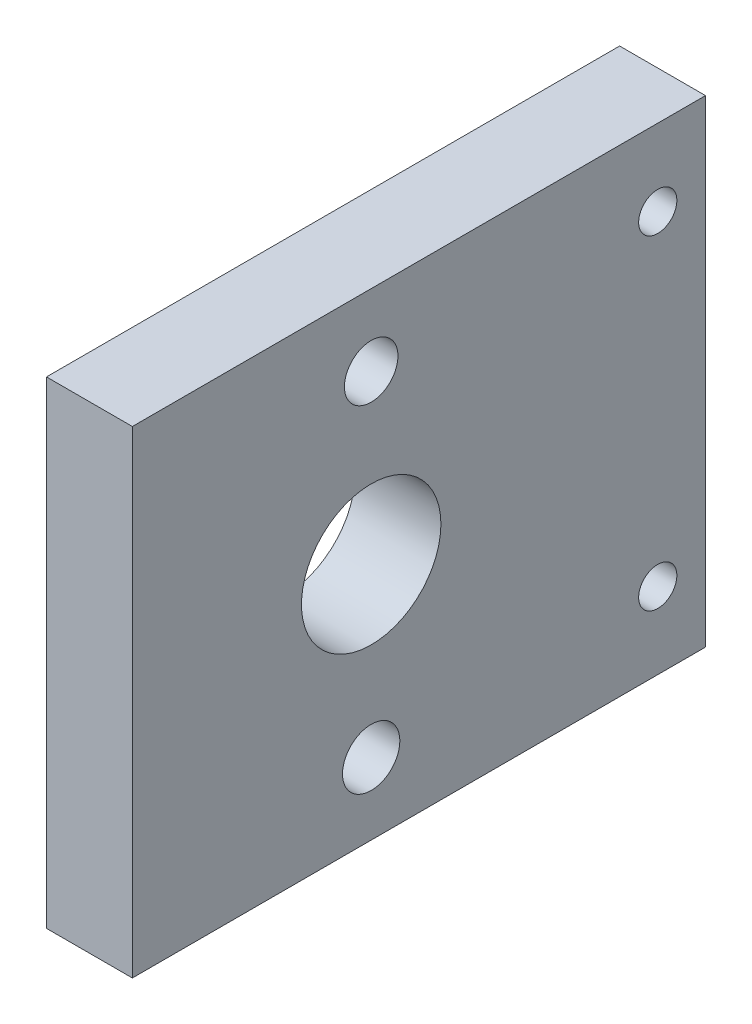
from build123d import *

# Parameters (mm, degrees)
RESSALTO_EXTRUS_O2_DEPTH      = 25
RESSALTO_EXTRUS_O2_DEPTH_BACK = 5
ESBO_O5_W                     = 4.495494134
ESBO_O5_H                     = 25
ESBO_O6_R                     = 1
CORTE_EXTRUS_O3_DEPTH         = 10
ESBO_O7_R                     = 1
CORTE_EXTRUS_O4_DEPTH         = 10
ESBO_O8_R                     = 3.65
CORTE_EXTRUS_O5_DEPTH         = 10
ESBO_O9_R                     = 1.4
CORTE_EXTRUS_O6_DEPTH         = 10
ESBO_O10_R                    = 1.5
CORTE_EXTRUS_O7_DEPTH         = 10


with BuildPart() as part:
    # Esboço5 → Ressalto-extrusão2 (new, two sides: drawn at the far end of the back side and taken through both)
    with BuildSketch(Plane.XY.offset(5).offset(-RESSALTO_EXTRUS_O2_DEPTH_BACK)):
        with Locations((-50.563178661, 37.985502959)):
            Rectangle(ESBO_O5_W, ESBO_O5_H)
    extrude(amount=RESSALTO_EXTRUS_O2_DEPTH + RESSALTO_EXTRUS_O2_DEPTH_BACK)

    # Esboço6 → Corte-extrusão3 (cut)
    with BuildSketch(Plane.ZY.offset(52.810925728)):
        with Locations((2.5, 46.485502959)):
            Circle(ESBO_O6_R)
    extrude(amount=-CORTE_EXTRUS_O3_DEPTH, mode=Mode.SUBTRACT)

    # Esboço7 → Corte-extrusão4 (cut)
    with BuildSketch(Plane.ZY.offset(52.810925728)):
        with Locations((2.5, 29.485502959)):
            Circle(ESBO_O7_R)
    extrude(amount=-CORTE_EXTRUS_O4_DEPTH, mode=Mode.SUBTRACT)

    # Esboço8 → Corte-extrusão5 (cut)
    with BuildSketch(Plane(origin=(-48.315431594, 0, 0), x_dir=(0, 0, -1), z_dir=(1, 0, 0))):
        with Locations((-17.5, 37.985502959)):
            Circle(ESBO_O8_R)
    extrude(amount=-CORTE_EXTRUS_O5_DEPTH, mode=Mode.SUBTRACT)

    # Esboço9 → Corte-extrusão6 (cut)
    with BuildSketch(Plane.ZY.offset(52.810925728)):
        with Locations((17.5, 46.735502959)):
            Circle(ESBO_O9_R)
    extrude(amount=-CORTE_EXTRUS_O6_DEPTH, mode=Mode.SUBTRACT)

    # Esboço10 → Corte-extrusão7 (cut)
    with BuildSketch(Plane.ZY.offset(52.810925728)):
        with Locations((17.5, 29.235502959)):
            Circle(ESBO_O10_R)
    extrude(amount=-CORTE_EXTRUS_O7_DEPTH, mode=Mode.SUBTRACT)


solid = part.part
